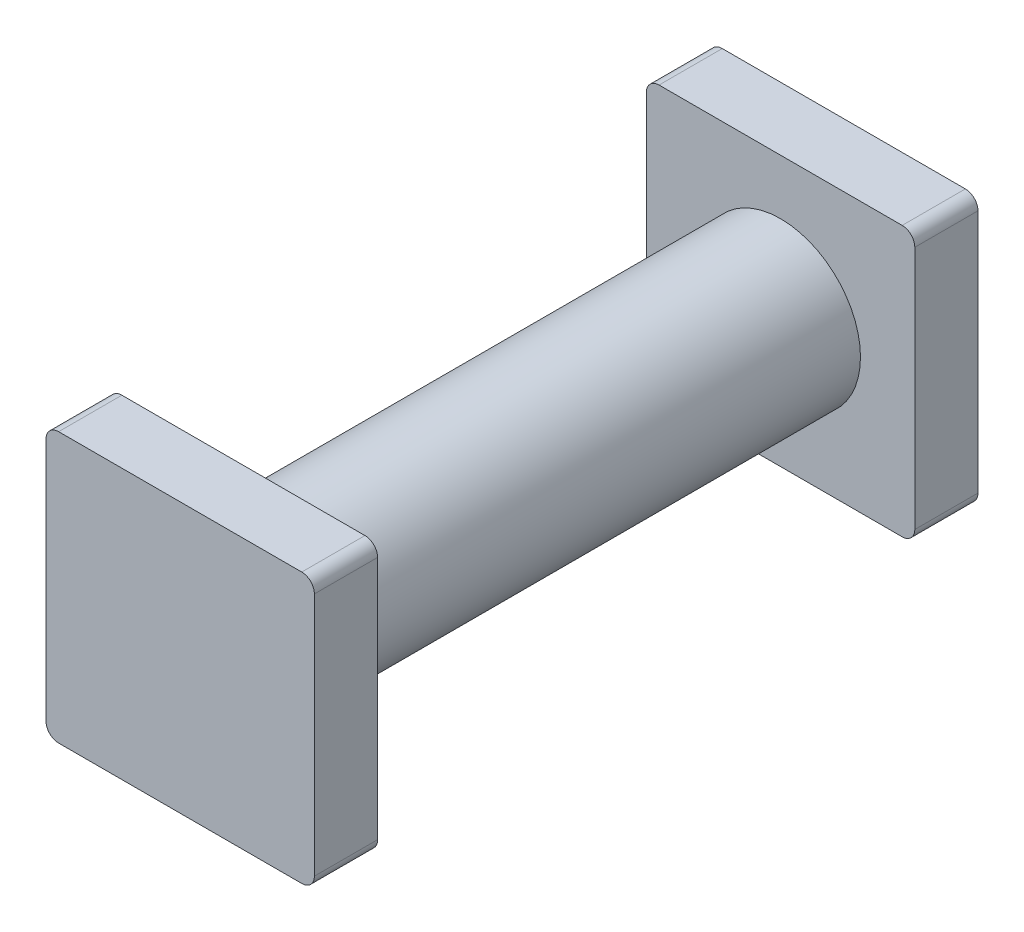
from build123d import *

# Parameters (mm, degrees)
SKETCH1_W           = 42.467218632
SKETCH1_H           = 42.674431579
BOSS_EXTRUDE1_DEPTH = 10
SKETCH2_R           = 12.637375282
BOSS_EXTRUDE2_DEPTH = 89
SKETCH4_W           = 42.467218632
SKETCH4_H           = 42.674431579
BOSS_EXTRUDE3_DEPTH = 10
FILLET1_R           = 2


with BuildPart() as part:
    # Sketch1 → Boss-Extrude1 (new body)
    with BuildSketch(Plane.XY):
        with Locations((-94.578448042, -284.38200622)):
            Rectangle(SKETCH1_W, SKETCH1_H)
    extrude(amount=BOSS_EXTRUDE1_DEPTH)

    # Sketch2 → Boss-Extrude2 (add)
    with BuildSketch(Plane.XY.offset(10)):
        with Locations((-94.578448042, -284.38200622)):
            Circle(SKETCH2_R)
    extrude(amount=BOSS_EXTRUDE2_DEPTH)

    # Sketch4 → Boss-Extrude3 (add)
    with BuildSketch(Plane(origin=(0, 0, 105), x_dir=(-1, 0, 0), z_dir=(0, 0, -1))):
        with Locations((94.578448042, -284.38200622)):
            Rectangle(SKETCH4_W, SKETCH4_H)
    extrude(amount=BOSS_EXTRUDE3_DEPTH)

    # Fillet1
    fillet1_edges = [part.edges().sort_by_distance(p)[0] for p in [
        (-73.344838726, -263.044790431, 100),
        (-73.344838726, -305.71922201, 100),
        (-115.812057358, -305.71922201, 100),
        (-115.812057358, -263.044790431, 100),
        (-73.344838726, -305.71922201, 5),
        (-115.812057358, -305.71922201, 5),
        (-115.812057358, -263.044790431, 5),
        (-73.344838726, -263.044790431, 5),
    ]]
    fillet(fillet1_edges, radius=FILLET1_R)


solid = part.part
